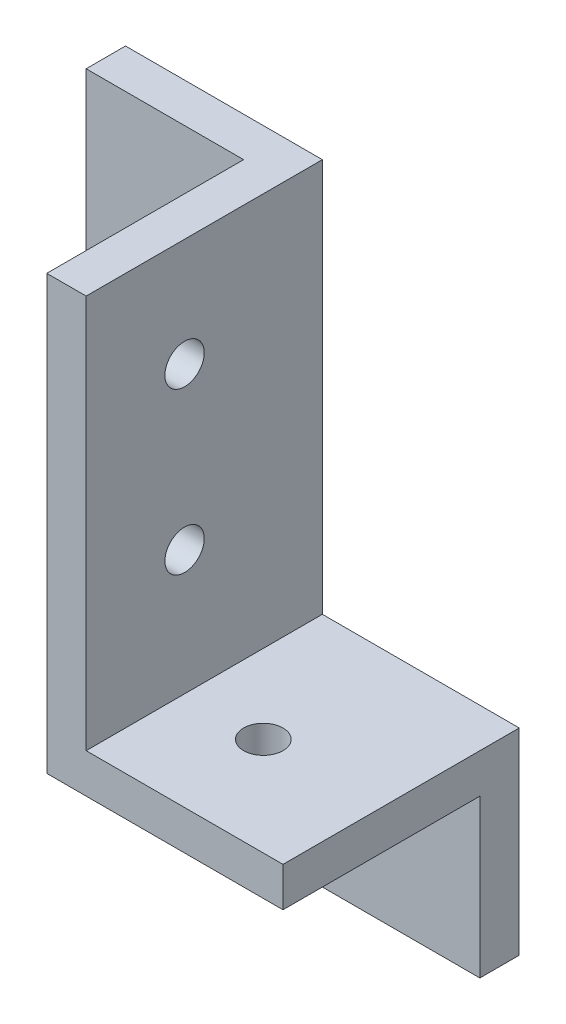
from build123d import *

# Parameters (mm, degrees)
BOSS_EXTRUDE1_DEPTH = 10
BOSS_EXTRUDE2_DEPTH = 50
SKETCH3_R           = 5
CUT_EXTRUDE1_DEPTH  = 188.082869339
SKETCH4_R           = 5
CUT_EXTRUDE2_DEPTH  = 10
SKETCH5_R           = 5
CUT_EXTRUDE3_DEPTH  = 10


with BuildPart() as part:
    # Sketch1 → Boss-Extrude1 (new body)
    with BuildSketch(Plane.XY):
        Polygon((0, 150), (50, 150), (50, 50), (100, 50), (100, 0), (0, 0), align=None)
    extrude(amount=BOSS_EXTRUDE1_DEPTH)

    # Sketch2 → Boss-Extrude2 (add)
    with BuildSketch(Plane.XY.offset(10)):
        Polygon((40, 150), (40, 40), (100, 40), (100, 50), (50, 50), (50, 150), align=None)
    extrude(amount=BOSS_EXTRUDE2_DEPTH)

    # Sketch3 → Cut-Extrude1 (cut, through all)
    with BuildSketch(Plane.XY.offset(10)):
        with Locations((20, 20)):
            Circle(SKETCH3_R)
        with Locations((20, 120)):
            Circle(SKETCH3_R)
        with Locations((20, 75)):
            Circle(SKETCH3_R)
        with Locations((70, 20)):
            Circle(SKETCH3_R)
    extrude(amount=-CUT_EXTRUDE1_DEPTH, mode=Mode.SUBTRACT)

    # Sketch4 → Cut-Extrude2 (cut)
    with BuildSketch(Plane.ZY.offset(-40)):
        with Locations(Location((35, 122.555580901, 0), (0, 0, 270))):
            Circle(SKETCH4_R)
        with Locations(Location((35, 81.685491979, 0), (0, 0, 270))):
            Circle(SKETCH4_R)
    extrude(amount=-CUT_EXTRUDE2_DEPTH, mode=Mode.SUBTRACT)

    # Sketch5 → Cut-Extrude3 (cut)
    with BuildSketch(Plane.XZ.offset(-40)):
        with Locations(Location((70, 35, 0), (0, 0, 270))):
            Circle(SKETCH5_R)
    extrude(amount=-CUT_EXTRUDE3_DEPTH, mode=Mode.SUBTRACT)


solid = part.part
